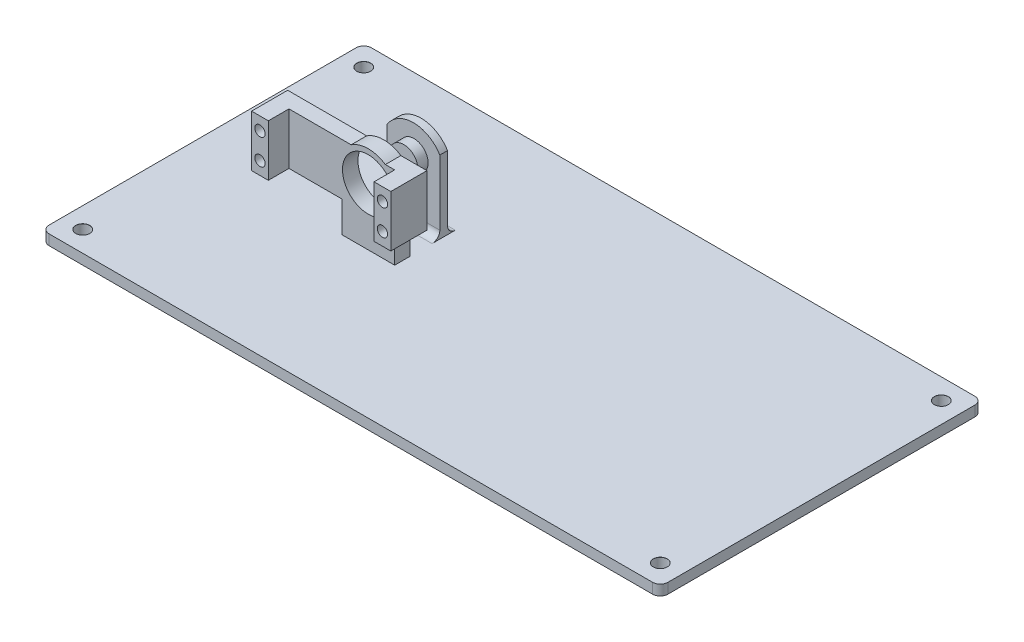
from build123d import *

# Parameters (mm, degrees)
SKETCH_1_W                        = 240
SKETCH_1_H                        = 125
EXTRUDE_1_DEPTH                   = 4
HOLE_WIZARD_5_4_5_4_1_D           = 5.4
HOLE_WIZARD_5_4_5_4_1_CSINK_D     = 5.45
HOLE_WIZARD_5_4_5_4_1_CSINK_ANGLE = 90
FILLET_1_R                        = 3
SKETCH_5_R                        = 10
EXTRUDE_2_DEPTH                   = 6
EXTRUDE_START                     = 14.5
EXTRUDE_3_DEPTH                   = 3
FILLET_2_R                        = 3
SKETCH_8_W                        = 6.5
SKETCH_8_H                        = 20
EXTRUDE_4_DEPTH                   = 8
SKETCH_10_R                       = 2
CUT_EXTRUDE_1_DEPTH               = 148.296469747
SKETCH_11_R                       = 5.486659136
EXTRUDE_5_DEPTH                   = 7


with BuildPart() as part:
    # 草图1 → 凸台-拉伸1 (new body)
    with BuildSketch(Plane(origin=(0, 0, 0), x_dir=(1, 0, 0), z_dir=(0, 1, 0))):
        Rectangle(SKETCH_1_W, SKETCH_1_H)
    extrude(amount=EXTRUDE_1_DEPTH)

    # Ø5.4 (5.4) 直径孔1 (through all)
    with Locations(Plane(origin=(0, 4, 0), x_dir=(1, 0, 0), z_dir=(0, 1, 0))):
        with Locations((112, 54.5), (-112, 54.5), (-112, -54.5), (112, -54.5)):
            CounterSinkHole(HOLE_WIZARD_5_4_5_4_1_D / 2, HOLE_WIZARD_5_4_5_4_1_CSINK_D / 2, counter_sink_angle=HOLE_WIZARD_5_4_5_4_1_CSINK_ANGLE)

    # 圆角1
    fillet_1_edges = [part.edges().sort_by_distance(p)[0] for p in [
        (120, 2, 62.5),
        (-120, 2, 62.5),
        (-120, 2, -62.5),
        (120, 2, -62.5),
    ]]
    fillet(fillet_1_edges, radius=FILLET_1_R)

    # 草图5 → 凸台-拉伸2 (add)
    with BuildSketch(Plane.XY):
        with BuildLine():
            Line((-60, 4), (-39.5, 4))
            Line((-39.5, 4), (-39.5, 16))
            Line((-39.5, 16), (-33, 16))
            Line((-33, 16), (-33, 36))
            Line((-33, 36), (-43.116750419, 36))
            ThreePointArc((-43.116750419, 36), (-49.75, 38), (-56.383249581, 36))
            Line((-56.383249581, 36), (-87, 36))
            Line((-87, 36), (-87, 16))
            Line((-87, 16), (-60, 16))
            Line((-60, 16), (-60, 4))
        make_face()
        with Locations((-49.75, 26)):
            Circle(SKETCH_5_R, mode=Mode.SUBTRACT)
    extrude(amount=EXTRUDE_2_DEPTH)

    # 草图6 → 凸台-拉伸3 (add)
    with BuildSketch(Plane(origin=(0, 0, 0), x_dir=(-1, 0, 0), z_dir=(0, 0, -1)).offset(EXTRUDE_START)):
        with BuildLine():
            Line((39.5, 4), (60, 4))
            Line((60, 4), (60, 32.239991987))
            ThreePointArc((60, 32.239991987), (49.75, 38), (39.5, 32.239991987))
            Line((39.5, 32.239991987), (39.5, 4))
        make_face()
    extrude(amount=-EXTRUDE_3_DEPTH)

    # 圆角2
    fillet_2_edges = [part.edges().sort_by_distance(p)[0] for p in [
        (-49.75, 4, -11.5),
        (-49.75, 4, -14.5),
    ]]
    fillet(fillet_2_edges, radius=FILLET_2_R)

    # 草图8 → 凸台-拉伸4 (add)
    with BuildSketch(Plane.XY.offset(6)):
        with Locations((-36.25, 26)):
            Rectangle(SKETCH_8_W, SKETCH_8_H)
        with Locations((-83.75, 26)):
            Rectangle(SKETCH_8_W, SKETCH_8_H)
    extrude(amount=EXTRUDE_4_DEPTH)

    # 草图10 → 切除-拉伸1 (cut, through all)
    with BuildSketch(Plane.XY.offset(14)):
        with Locations((-83.75, 31)):
            Circle(SKETCH_10_R)
        with Locations((-83.75, 21)):
            Circle(SKETCH_10_R)
        with Locations((-36.25, 21)):
            Circle(SKETCH_10_R)
        with Locations((-36.25, 31)):
            Circle(SKETCH_10_R)
    extrude(amount=-CUT_EXTRUDE_1_DEPTH, mode=Mode.SUBTRACT)

    # 草图11 → 凸台-拉伸5 (add)
    with BuildSketch(Plane(origin=(0, 0, -14.5), x_dir=(-1, 0, 0), z_dir=(0, 0, -1))):
        with Locations((49.501785155, 27.302934709)):
            Circle(SKETCH_11_R)
    extrude(amount=-EXTRUDE_5_DEPTH)


solid = part.part
